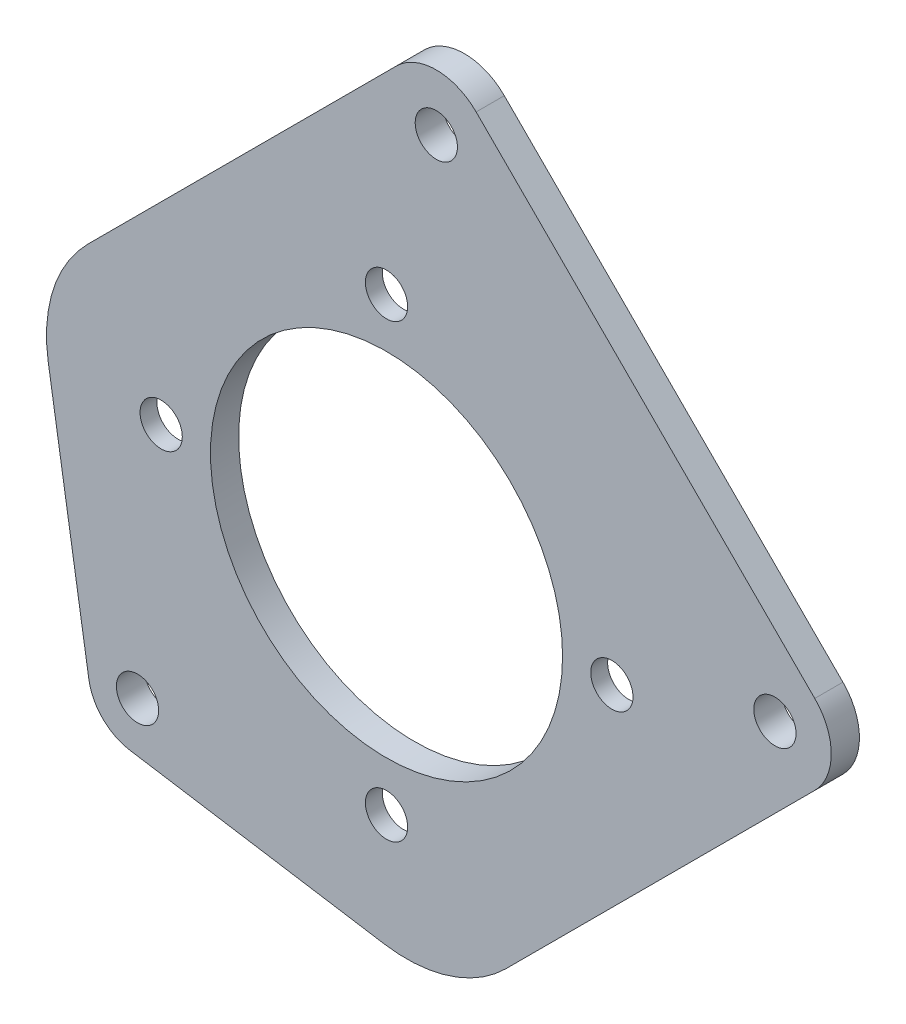
from build123d import *
from OCP.BRepFilletAPI import BRepFilletAPI_MakeChamfer

# Parameters (mm, degrees)
SKICA1_R                = 12.5
SKICA1_R_2              = 1.5
P_IDAT_VYSUNUT_M1_DEPTH = 2
ZKOSEN_1_SIZE           = 0.8
ZKOSEN_1_SIZE2          = 1.385640646


with BuildPart() as part:
    # Skica1 → Přidat vysunutím1 (new body)
    with BuildSketch(Plane.XY):
        with BuildLine():
            Line((6.363961031, 30.405591591), (30.405591591, 6.363961031))
            ThreePointArc((30.405591591, 6.363961031), (31.577164466, 3.535533906), (30.405591591, 0.707106781))
            Line((30.405591591, 0.707106781), (8.485281374, -21.213203436))
            ThreePointArc((8.485281374, -21.213203436), (4.498831017, -23.654503108), (-0.161661635, -24.01718587))
            Line((-0.161661635, -24.01718587), (-18.229225849, -21.133937116))
            ThreePointArc((-18.229225849, -21.133937116), (-20.152543264, -20.152543264), (-21.133937116, -18.229225849))
            Line((-21.133937116, -18.229225849), (-24.01718587, -0.161661635))
            ThreePointArc((-24.01718587, -0.161661635), (-23.654503108, 4.498831017), (-21.213203436, 8.485281374))
            Line((-21.213203436, 8.485281374), (0.707106781, 30.405591591))
            ThreePointArc((0.707106781, 30.405591591), (3.535533906, 31.577164466), (6.363961031, 30.405591591))
        make_face()
        Circle(SKICA1_R, mode=Mode.SUBTRACT)
        with Locations((0, 16)):
            Circle(SKICA1_R_2, mode=Mode.SUBTRACT)
        with Locations((16, 0)):
            Circle(SKICA1_R_2, mode=Mode.SUBTRACT)
        with Locations((0, -16)):
            Circle(SKICA1_R_2, mode=Mode.SUBTRACT)
        with Locations((-16, 0)):
            Circle(SKICA1_R_2, mode=Mode.SUBTRACT)
        with Locations((-17.67766953, -17.67766953)):
            Circle(SKICA1_R_2, mode=Mode.SUBTRACT)
        with Locations((27.577164466, 3.535533906)):
            Circle(SKICA1_R_2, mode=Mode.SUBTRACT)
        with Locations(Location((3.535533906, 27.577164466, 0), (0, 0, 180))):
            Circle(SKICA1_R_2, mode=Mode.SUBTRACT)
    extrude(amount=P_IDAT_VYSUNUT_M1_DEPTH)

    # Zkosení1: one chamfer whose edges measure the first distance from different faces: ONE call of the kernel's chamfer builder (chamfer() names one face for all edges)
    zkosen_1_edges_1 = [part.edges().sort_by_distance(p)[0] for p in [
        (-1.5, 16, 0),
    ]]
    zkosen_1_side_1 = [part.faces().sort_by_distance(p)[0] for p in [
        (-1.5, 16, 1),
    ]]
    zkosen_1_edges_2 = [part.edges().sort_by_distance(p)[0] for p in [
        (14.5, 0, 0),
    ]]
    zkosen_1_side_2 = [part.faces().sort_by_distance(p)[0] for p in [
        (14.5, 0, 1),
    ]]
    zkosen_1_edges_3 = [part.edges().sort_by_distance(p)[0] for p in [
        (-1.5, -16, 0),
    ]]
    zkosen_1_side_3 = [part.faces().sort_by_distance(p)[0] for p in [
        (-1.5, -16, 1),
    ]]
    zkosen_1_edges_4 = [part.edges().sort_by_distance(p)[0] for p in [
        (-17.5, 0, 0),
    ]]
    zkosen_1_side_4 = [part.faces().sort_by_distance(p)[0] for p in [
        (-17.5, 0, 1),
    ]]
    zkosen_1 = BRepFilletAPI_MakeChamfer(part.part.solid().wrapped)
    for e in zkosen_1_edges_1:
        zkosen_1.Add(ZKOSEN_1_SIZE, ZKOSEN_1_SIZE2, e.wrapped, zkosen_1_side_1[0].wrapped)  # the first distance lies on this face
    for e in zkosen_1_edges_2:
        zkosen_1.Add(ZKOSEN_1_SIZE, ZKOSEN_1_SIZE2, e.wrapped, zkosen_1_side_2[0].wrapped)  # the first distance lies on this face
    for e in zkosen_1_edges_3:
        zkosen_1.Add(ZKOSEN_1_SIZE, ZKOSEN_1_SIZE2, e.wrapped, zkosen_1_side_3[0].wrapped)  # the first distance lies on this face
    for e in zkosen_1_edges_4:
        zkosen_1.Add(ZKOSEN_1_SIZE, ZKOSEN_1_SIZE2, e.wrapped, zkosen_1_side_4[0].wrapped)  # the first distance lies on this face
    add(Compound.cast(zkosen_1.Shape()), mode=Mode.REPLACE)


solid = part.part
